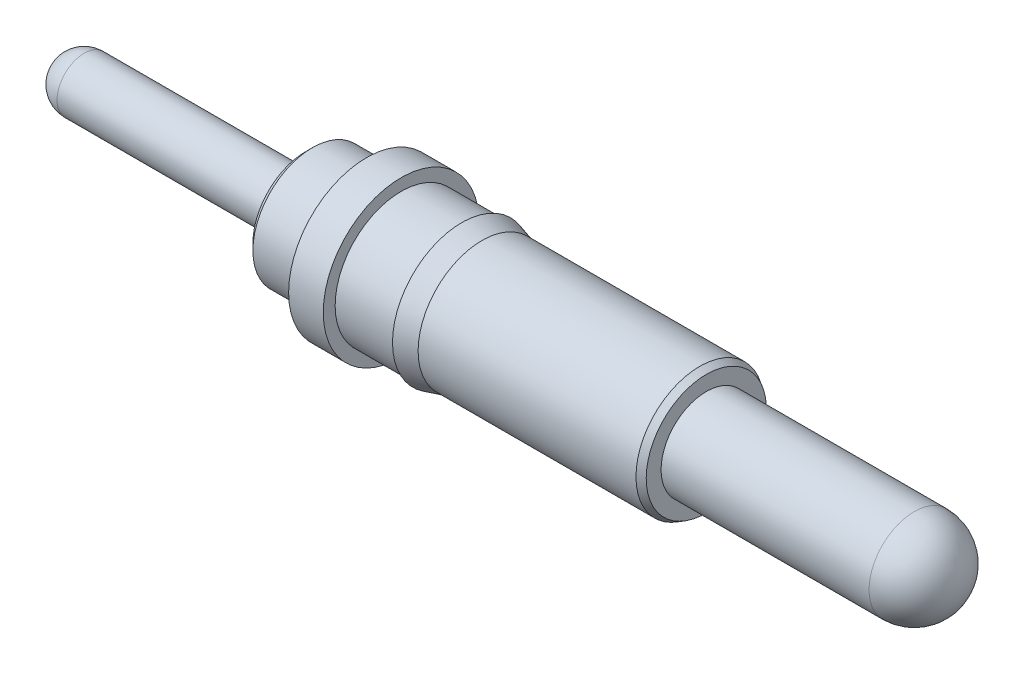
from build123d import *


with BuildPart() as part:
    # Sketch1 → Revolve1 (revolve)
    with BuildSketch(Plane.XY, mode=Mode.PRIVATE) as revolve1_sk:
        with BuildLine():
            Line((0, 0), (10.5918, 0))
            ThreePointArc((10.5918, 0), (10.436314706, 0.375374706), (10.06094, 0.53086))
            Line((10.06094, 0.53086), (7.62, 0.53086))
            Line((7.62, 0.53086), (7.62, 0.705305909))
            Line((7.62, 0.705305909), (7.5438, 0.7493))
            Line((7.5438, 0.7493), (4.986785226, 0.7493))
            Line((4.986785226, 0.7493), (4.7498, 0.8128))
            Line((4.7498, 0.8128), (4.7498, 0.7747))
            Line((4.7498, 0.7747), (4.0386, 0.7747))
            Line((4.0386, 0.7747), (4.0386, 0.9144))
            Line((4.0386, 0.9144), (3.6322, 0.9144))
            Line((3.6322, 0.9144), (3.6322, 0.6985))
            Line((3.6322, 0.6985), (2.9972, 0.6985))
            Line((2.9972, 0.6985), (2.921, 0.6223))
            Line((2.921, 0.6223), (2.921, 0.3175))
            Line((2.921, 0.3175), (0.3175, 0.3175))
            ThreePointArc((0.3175, 0.3175), (0.092993597, 0.224506403), (0, 0))
        make_face()
    revolve(revolve1_sk.sketch.rotate(Axis((0, 0, 0), (1, 0, 0)), 90), axis=Axis((0, 0, 0), (1, 0, 0)))


solid = part.part
